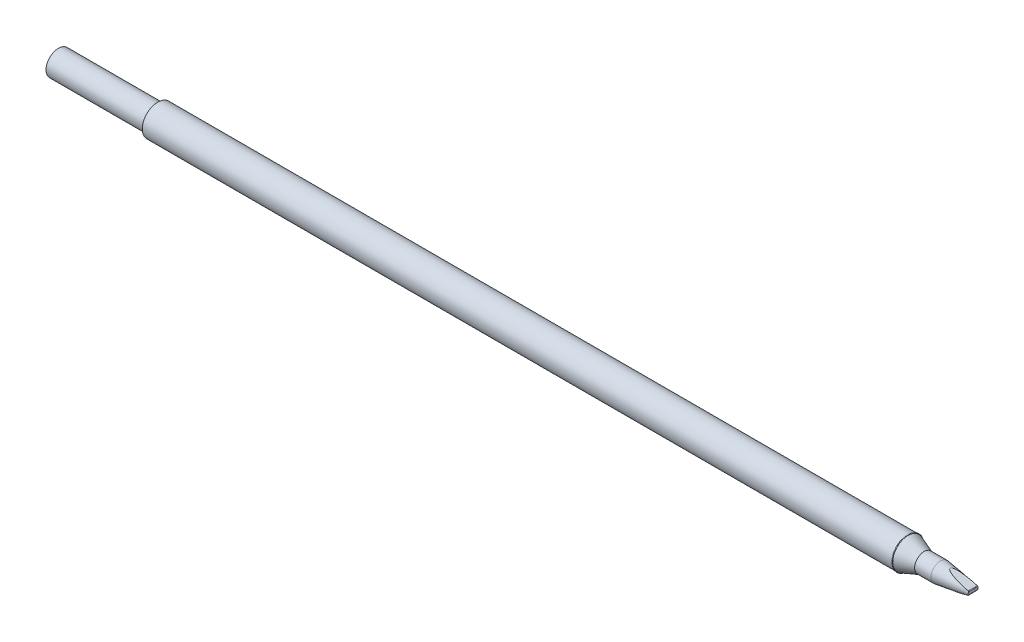
from build123d import *

# Parameters (mm, degrees)
FILLET1_R          = 0.45
CHAMFER1_SIZE      = 0.2
CHAMFER1_SIZE2     = 0.346410162
SKETCH2_R          = 0.05
CUT_EXTRUDE1_DEPTH = 5
FILLET3_R          = 0.1


with BuildPart() as part:
    # Sketch1 → Revolve1 (revolve)
    with BuildSketch(Plane.XY, mode=Mode.PRIVATE) as revolve1_sk:
        Polygon((0, 0), (-15, 0), (-15, 0.5), (0, 0.5), (0, 1.49), (-15, 1.49), (-15, 1.9), (0, 1.9), (0, 2.365), (115, 2.365), (117.5, 1.45), (120, 1.45), (125, 0.75), (125, 0), align=None)
    revolve(revolve1_sk.sketch.rotate(Axis((0, 0, 0), (1, 0, 0)), 90), axis=Axis((0, 0, 0), (1, 0, 0)))

    # Fillet1
    fillet1_edges = [part.edges().sort_by_distance(p)[0] for p in [
        (-15, 0, -0.5),
    ]]
    fillet(fillet1_edges, radius=FILLET1_R)

    # Chamfer1
    chamfer1_edges = [part.edges().sort_by_distance(p)[0] for p in [
        (0, 0, -2.365),
    ]]
    chamfer1_side = [part.faces().sort_by_distance(p)[0] for p in [
        (57.5, 0, -2.365),
    ]]
    chamfer(chamfer1_edges, length=CHAMFER1_SIZE, length2=CHAMFER1_SIZE2, reference=chamfer1_side[0])

    # Sketch2 → Revolve2 (revolve)
    with BuildSketch(Plane.XY, mode=Mode.PRIVATE) as revolve2_sk:
        with Locations((115, 2.365)):
            Circle(SKETCH2_R)
    revolve(revolve2_sk.sketch.rotate(Axis((0, 0, 0), (1, 0, 0)), 270), axis=Axis((0, 0, 0), (1, 0, 0)))

    # Sketch3 → Cut-Extrude1 (cut, symmetric)
    with BuildSketch(Plane.XY):
        Polygon((120, 1.65), (126, 0), (120, -1.65), (129.159329982, -1.65), (129.159329982, 1.65), align=None)
    extrude(amount=CUT_EXTRUDE1_DEPTH, both=True, mode=Mode.SUBTRACT)

    # Fillet3
    fillet3_edges = [part.edges().sort_by_distance(p)[0] for p in [
        (125, -0.275, 0),
        (125, 0.275, 0),
    ]]
    fillet(fillet3_edges, radius=FILLET3_R)


solid = part.part
